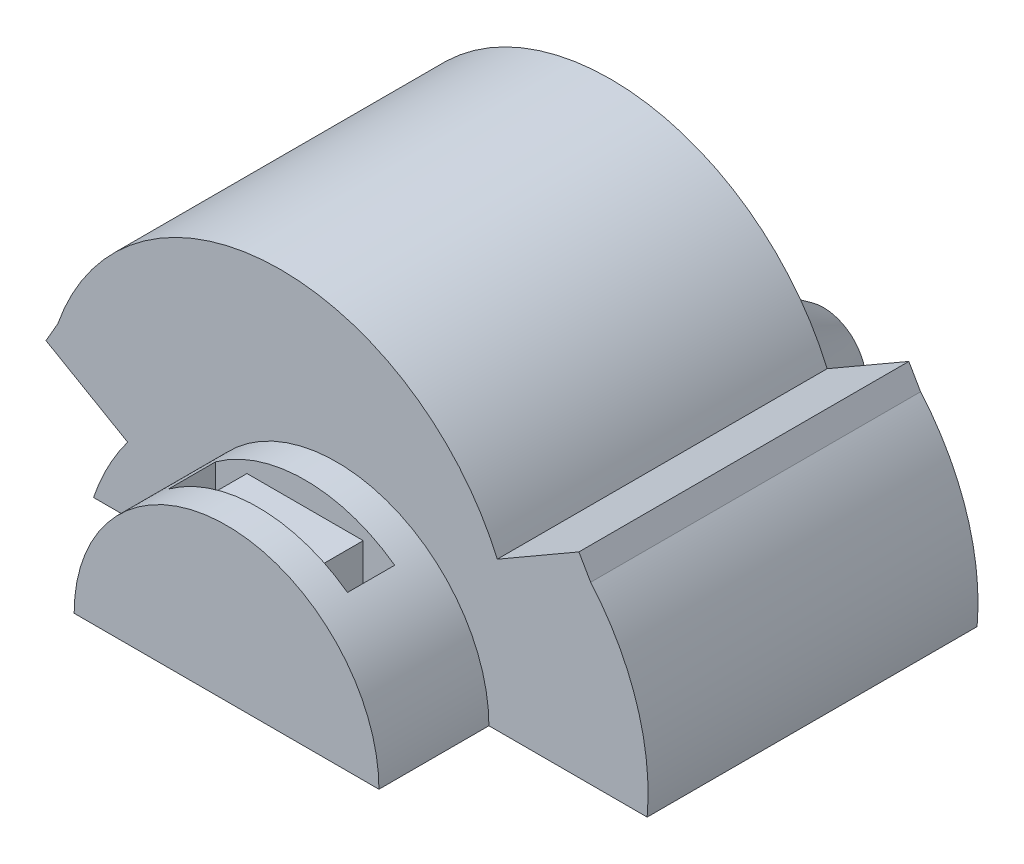
from build123d import *

# Parameters (mm, degrees)
SALIENTE_EXTRUIR1_DEPTH = 18
SALIENTE_EXTRUIR2_START = 1.5
CROQUIS2_R              = 2.7
SALIENTE_EXTRUIR2_DEPTH = 1.5
SALIENTE_EXTRUIR3_DEPTH = 1.5
CROQUIS6_W              = 5.4
CROQUIS6_H              = 1.803822617
SALIENTE_EXTRUIR7_DEPTH = 10
CROQUIS10_W             = 5.4
CROQUIS10_H             = 10
CORTAR_EXTRUIR3_DEPTH   = 10
CROQUIS12_W             = 50.345864286
CROQUIS12_H             = 43.398115734
CORTAR_EXTRUIR4_DEPTH   = 30
CROQUIS14_W             = 2
CROQUIS14_H             = 3
CORTAR_EXTRUIR5_DEPTH   = 30
CROQUIS15_W             = 3
CROQUIS15_H             = 9.965395542
CROQUIS15_H_2           = 4.625035451
CORTAR_EXTRUIR6_DEPTH   = 7.4
CROQUIS16_W             = 3.7
CROQUIS16_H             = 3
REVOLUCI_N2_ANGLE       = 180
CROQUIS17_W             = 0.5
CROQUIS17_H             = 9
REVOLUCI_N3_ANGLE       = 180


with BuildPart() as part:
    # Croquis1 → Saliente-Extruir1 (new body)
    with BuildSketch(Plane.XY):
        with BuildLine():
            Line((-53.667784589, 33.4650382), (-54.417784589, 34.764076306))
            Line((-54.417784589, 34.764076306), (-59.613937012, 31.764076306))
            ThreePointArc((-59.613937012, 31.764076306), (-73.945502317, 40.827707086), (-87.584573208, 30.752047693))
            Line((-87.584573208, 30.752047693), (-88.334573208, 29.453009587))
            Line((-88.334573208, 29.453009587), (-83.138420786, 26.453009587))
            ThreePointArc((-83.138420786, 26.453009587), (-83.82197264, 9.509694567), (-68.276660199, 2.735742387))
            Line((-68.276660199, 2.735742387), (-66.776660199, 2.735742387))
            Line((-66.776660199, 2.735742387), (-66.776660199, 8.735742387))
            ThreePointArc((-66.776660199, 8.735742387), (-51.761543041, 16.615426627), (-53.667784589, 33.4650382))
        make_face()
        with BuildLine():
            Line((-54.507549641, 31.745180452), (-55.016343575, 32.626437397))
            Line((-55.016343575, 32.626437397), (-60.212495998, 29.626437397))
            ThreePointArc((-60.212495998, 29.626437397), (-72.508207296, 39.071771198), (-85.675250182, 30.884718699))
            Line((-85.675250182, 30.884718699), (-86.184044116, 30.003461754))
            Line((-86.184044116, 30.003461754), (-80.987891693, 27.003461754))
            ThreePointArc((-80.987891693, 27.003461754), (-83.019935064, 11.632396511), (-69.346218174, 4.322929129))
            Line((-69.346218174, 4.322929129), (-68.328630306, 4.322929129))
            Line((-68.328630306, 4.322929129), (-68.328630306, 10.322929129))
            ThreePointArc((-68.328630306, 10.322929129), (-54.000875637, 16.248660571), (-54.507549641, 31.745180452))
        make_face(mode=Mode.SUBTRACT)
    extrude(amount=SALIENTE_EXTRUIR1_DEPTH)

    # Croquis2 → Saliente-Extruir2 (add)
    with BuildSketch(Plane(origin=(0, 0, 0), x_dir=(-1, 0, 0), z_dir=(0, 0, -1)).offset(SALIENTE_EXTRUIR2_START)):
        with BuildLine():
            Line((87.584573208, 30.752047693), (88.334573208, 29.453009587))
            Line((88.334573208, 29.453009587), (83.138420786, 26.453009587))
            ThreePointArc((83.138420786, 26.453009587), (83.82197264, 9.509694567), (68.276660199, 2.735742387))
            Line((68.276660199, 2.735742387), (66.776660199, 2.735742387))
            Line((66.776660199, 2.735742387), (66.776660199, 8.735742387))
            ThreePointArc((66.776660199, 8.735742387), (51.761543041, 16.615426627), (53.667784589, 33.4650382))
            Line((53.667784589, 33.4650382), (54.417784589, 34.764076306))
            Line((54.417784589, 34.764076306), (59.613937012, 31.764076306))
            ThreePointArc((59.613937012, 31.764076306), (73.945502317, 40.827707086), (87.584573208, 30.752047693))
        make_face()
        with Locations((69.843005999, 22.317609427)):
            Circle(CROQUIS2_R, mode=Mode.SUBTRACT)
    extrude(amount=-SALIENTE_EXTRUIR2_DEPTH)

    # Croquis3 → Saliente-Extruir3 (add)
    with BuildSketch(Plane.XY.offset(18)):
        with BuildLine():
            Line((-66.776660199, 8.735742387), (-66.776660199, 2.735742387))
            Line((-66.776660199, 2.735742387), (-68.276660199, 2.735742387))
            ThreePointArc((-68.276660199, 2.735742387), (-83.82197264, 9.509694567), (-83.138420786, 26.453009587))
            Line((-83.138420786, 26.453009587), (-88.334573208, 29.453009587))
            Line((-88.334573208, 29.453009587), (-87.584573208, 30.752047693))
            ThreePointArc((-87.584573208, 30.752047693), (-73.945502317, 40.827707086), (-59.613937012, 31.764076306))
            Line((-59.613937012, 31.764076306), (-54.417784589, 34.764076306))
            Line((-54.417784589, 34.764076306), (-53.667784589, 33.4650382))
            ThreePointArc((-53.667784589, 33.4650382), (-51.761543041, 16.615426627), (-66.776660199, 8.735742387))
        make_face()
    extrude(amount=SALIENTE_EXTRUIR3_DEPTH)

    # Croquis6 → Saliente-Extruir7 (add)
    with BuildSketch(Plane(origin=(0, 0, -1.5), x_dir=(-1, 0, 0), z_dir=(0, 0, -1))):
        with Locations((69.843005999, 21.415698119)):
            Rectangle(CROQUIS6_W, CROQUIS6_H)
    extrude(amount=SALIENTE_EXTRUIR7_DEPTH)

    # Croquis10 → Cortar-Extruir3 (cut)
    with BuildSketch(Plane(origin=(0, 22.317609427, 0), x_dir=(1, 0, 0), z_dir=(0, 1, 0))):
        with Locations((-69.843005999, 6.5)):
            Rectangle(CROQUIS10_W, CROQUIS10_H)
    extrude(amount=-CORTAR_EXTRUIR3_DEPTH, mode=Mode.SUBTRACT)

    # Croquis11 → Revolución1 (revolve)
    with BuildSketch(Plane(origin=(0, 22.317609427, 0), x_dir=(1, 0, 0), z_dir=(0, 1, 0)), mode=Mode.PRIVATE) as revoluci_n1_sk:
        Polygon((-72.543005999, 1.5), (-79.543005999, 1.5), (-72.543005999, 11.5), align=None)
        Polygon((-71.193005999, -19.5), (-69.843005999, -19.5), (-69.843005999, -26.5), (-71.193005999, -26.5), (-79.543005999, -26.5), (-79.543005999, -19.5), align=None)
    revolve(revoluci_n1_sk.sketch.rotate(Axis((-69.843005999, 22.317609427, 19.5), (0, 0, 1)), 180), axis=Axis((-69.843005999, 22.317609427, 19.5), (0, 0, 1)))

    # Croquis12 → Cortar-Extruir4 (cut)
    with BuildSketch(Plane(origin=(0, 22.317609427, 0), x_dir=(1, 0, 0), z_dir=(0, 1, 0))):
        with Locations((-66.462924906, -7.850212976)):
            Rectangle(CROQUIS12_W, CROQUIS12_H)
    extrude(amount=-CORTAR_EXTRUIR4_DEPTH, mode=Mode.SUBTRACT)

    # Croquis14 → Cortar-Extruir5 (cut)
    with BuildSketch(Plane.XZ.offset(-22.317609427)):
        with Locations((-74.543005999, -4)):
            Rectangle(CROQUIS14_W, CROQUIS14_H)
        with Locations((-65.143005999, -4)):
            Rectangle(CROQUIS14_W, CROQUIS14_H)
        with Locations((-65.143005999, 23)):
            Rectangle(CROQUIS14_W, CROQUIS14_H)
        with Locations((-74.543005999, 23)):
            Rectangle(CROQUIS14_W, CROQUIS14_H)
    extrude(amount=-CORTAR_EXTRUIR5_DEPTH, mode=Mode.SUBTRACT)

    # Croquis15 → Cortar-Extruir6 (cut)
    with BuildSketch(Plane(origin=(-66.143005999, 0, 0), x_dir=(0, 0, -1), z_dir=(1, 0, 0))):
        with Locations((4, 33.124395109)):
            Rectangle(CROQUIS15_W, CROQUIS15_H)
        with Locations((-23, 32.834394335)):
            Rectangle(CROQUIS15_W, CROQUIS15_H_2)
    extrude(amount=-CORTAR_EXTRUIR6_DEPTH, mode=Mode.SUBTRACT)

    # Croquis16 → Revolución2 (revolve)
    with BuildSketch(Plane.XZ.offset(-22.317609427)):
        with Locations((-71.693005999, 16.5)):
            Rectangle(CROQUIS16_W, CROQUIS16_H)
    revolve(axis=Axis((-69.843005999, 22.317609427, 15), (0, 0, -1)), revolution_arc=REVOLUCI_N2_ANGLE)

    # Croquis17 → Revolución3 (revolve)
    with BuildSketch(Plane.XZ.offset(-22.317609427)):
        with Locations((-72.293005999, -7)):
            Rectangle(CROQUIS17_W, CROQUIS17_H)
    revolve(axis=Axis((-69.843005999, 22.317609427, 0), (0, 0, -1)), revolution_arc=REVOLUCI_N3_ANGLE)


solid = part.part
